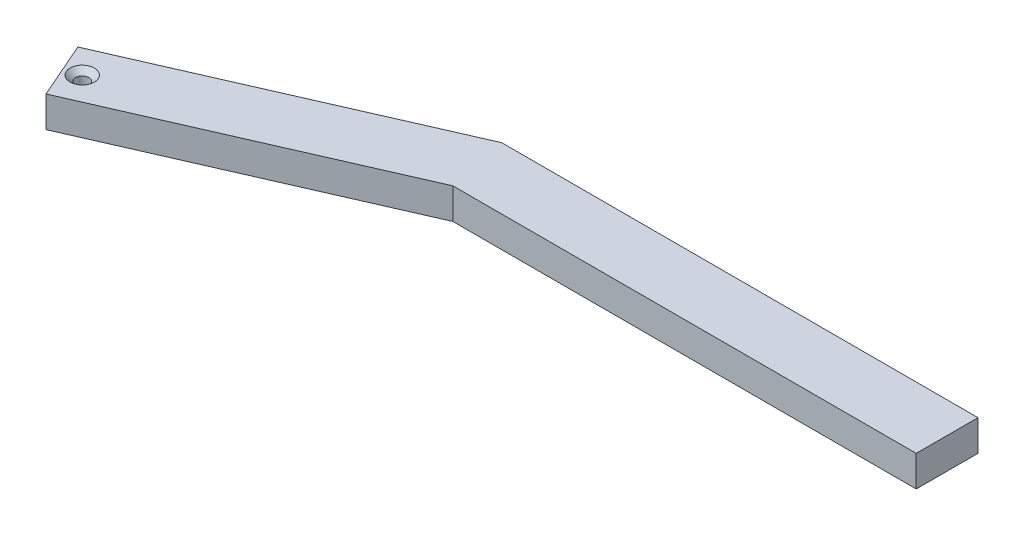
from build123d import *

# Parameters (mm, degrees)
BOSS_EXTRUDE1_DEPTH                              = 25.4
CSK_FOR_M10_FLAT_HEAD_MACHINE_SCREW1_D           = 11
CSK_FOR_M10_FLAT_HEAD_MACHINE_SCREW1_CSINK_D     = 20
CSK_FOR_M10_FLAT_HEAD_MACHINE_SCREW1_CSINK_ANGLE = 90


with BuildPart() as part:
    # Sketch1 → Boss-Extrude1 (new body)
    with BuildSketch(Plane(origin=(0, 0, 0), x_dir=(1, 0, 0), z_dir=(0, 1, 0))):
        Polygon((0, 0), (242.421488875, 106.122270026), (634.05352485, 106.122270026), (634.05352485, 55.322270026), (253.05352485, 55.322270026), (20.371725961, -46.536359778), align=None)
    extrude(amount=BOSS_EXTRUDE1_DEPTH)

    # CSK for M10 Flat Head Machine Screw1 (through all)
    with Locations(Plane(origin=(0, 25.4, 0), x_dir=(1, 0, 0), z_dir=(0, 1, 0))):
        with Locations((21.819952925, -18.175248399)):
            CounterSinkHole(CSK_FOR_M10_FLAT_HEAD_MACHINE_SCREW1_D / 2, CSK_FOR_M10_FLAT_HEAD_MACHINE_SCREW1_CSINK_D / 2, counter_sink_angle=CSK_FOR_M10_FLAT_HEAD_MACHINE_SCREW1_CSINK_ANGLE)


solid = part.part
